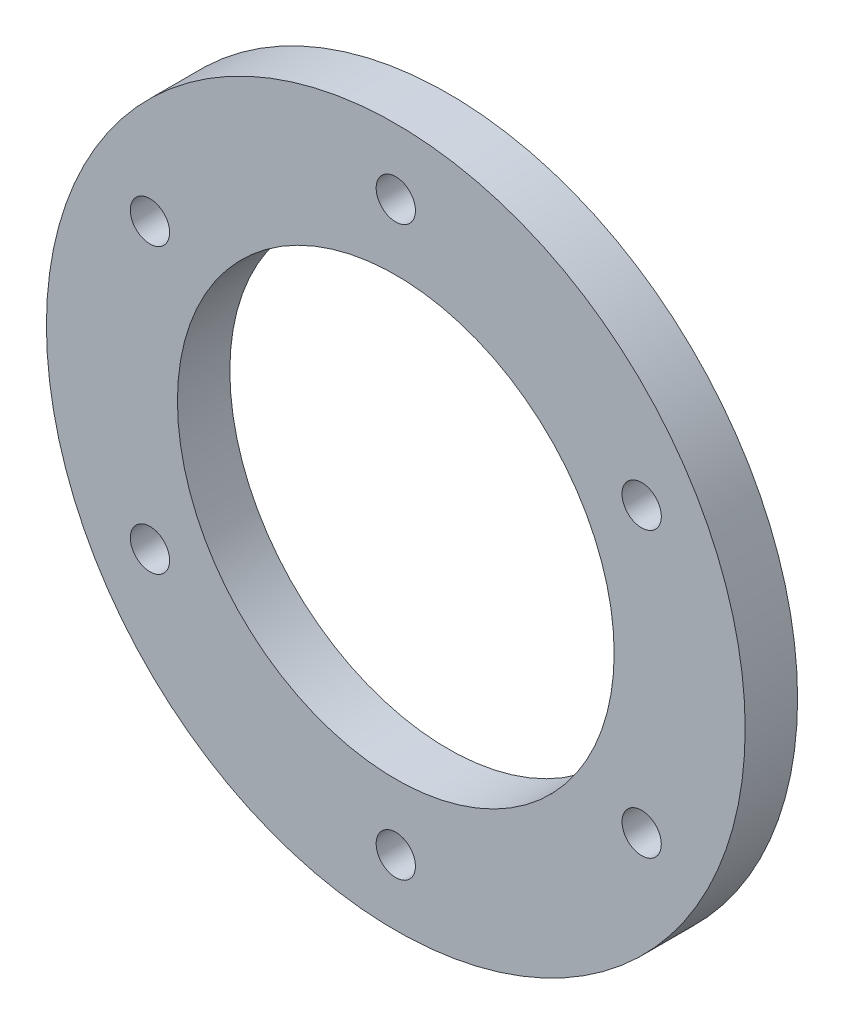
from build123d import *

# Parameters (mm, degrees)
SKETCH1_R           = 40
SKETCH1_R_2         = 25
BOSS_EXTRUDE1_DEPTH = 6
SKETCH2_R           = 2.25
CUT_EXTRUDE1_DEPTH  = 57.885850613
CIRPATTERN1_COUNT   = 6


with BuildPart() as part:
    # Sketch1 → Boss-Extrude1 (new body)
    with BuildSketch(Plane.XY):
        Circle(SKETCH1_R)
        Circle(SKETCH1_R_2, mode=Mode.SUBTRACT)
    extrude(amount=BOSS_EXTRUDE1_DEPTH)

    # Sketch2 → Cut-Extrude1 (cut, through all)
    with BuildSketch(Plane.XY):
        with Locations((0, 32.5)):
            Circle(SKETCH2_R)
    cut_extrude1 = extrude(amount=CUT_EXTRUDE1_DEPTH, mode=Mode.SUBTRACT)

    # CirPattern1: Cut-Extrude1 ×6 about axis
    cirpattern1_axis = Axis((0, 0, 6), (0, 0, 1))
    for i in range(1, CIRPATTERN1_COUNT):
        add(cut_extrude1.rotate(cirpattern1_axis, i * 360 / CIRPATTERN1_COUNT), mode=Mode.SUBTRACT)


solid = part.part
